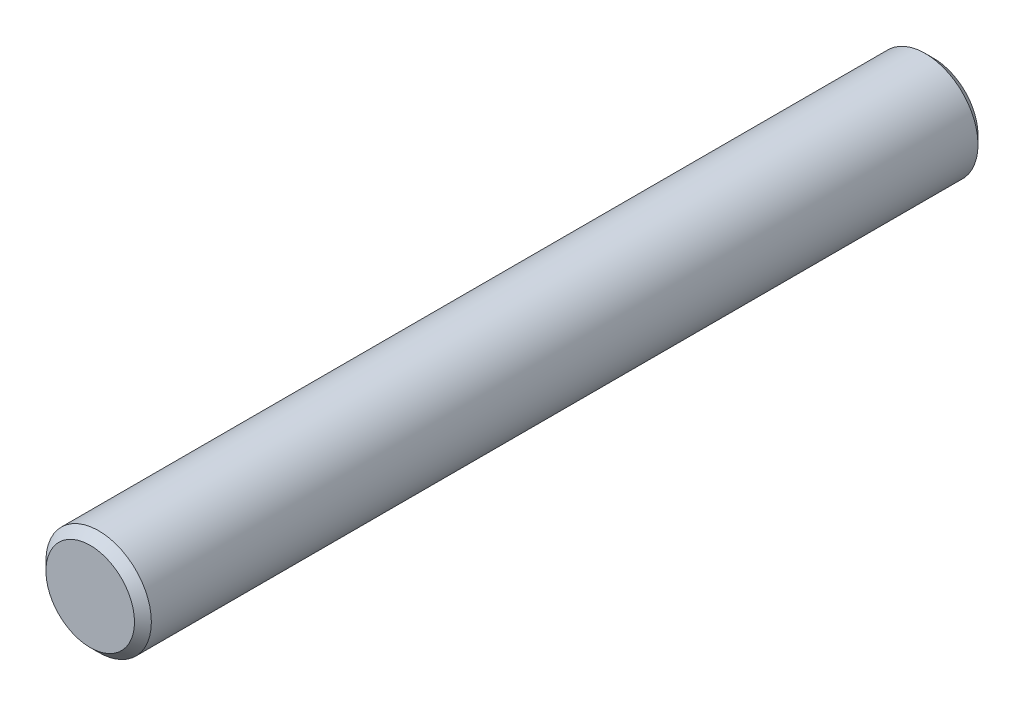
from build123d import *

# Parameters (mm, degrees)
SKETCH1_R           = 12.5
BOSS_EXTRUDE1_DEPTH = 200
CHAMFER1_SIZE       = 2


with BuildPart() as part:
    # Sketch1 → Boss-Extrude1 (new body)
    with BuildSketch(Plane.XY):
        Circle(SKETCH1_R)
    extrude(amount=BOSS_EXTRUDE1_DEPTH)

    # Chamfer1
    chamfer1_edges = [part.edges().sort_by_distance(p)[0] for p in [
        (-12.5, 0, 0),
        (-12.5, 0, 200),
    ]]
    chamfer(chamfer1_edges, length=CHAMFER1_SIZE)


solid = part.part
